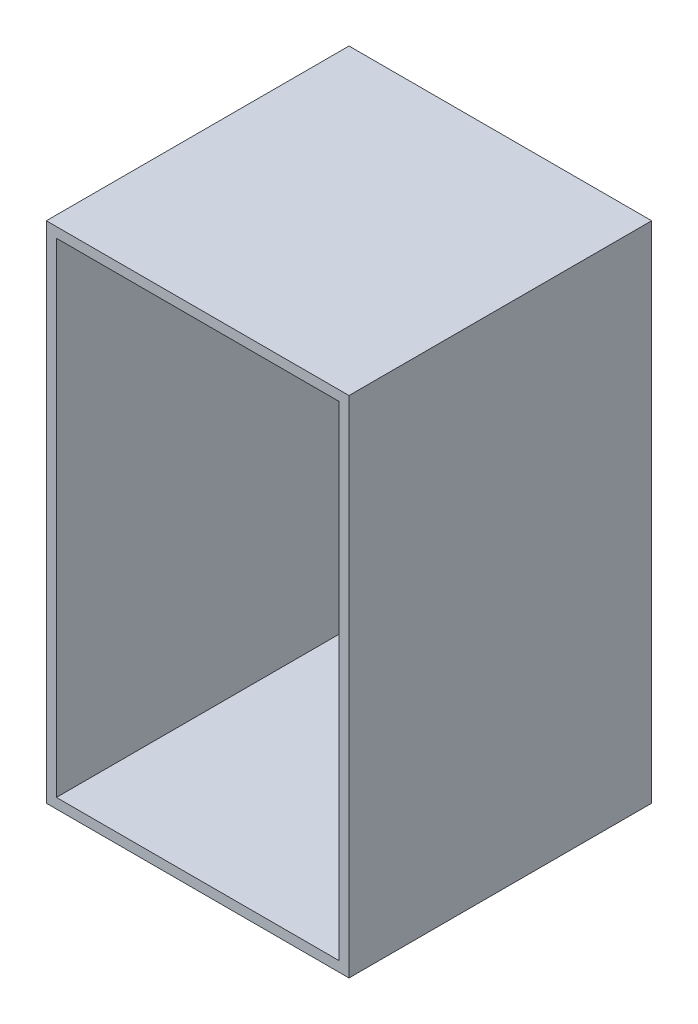
from build123d import *

# Parameters (mm, degrees)
SKETCH1_W                       = 76.2
SKETCH1_H                       = 76.2
BOX_DEPTH                       = 127
HOLLOW_IT_T                     = -2.54
SKETCH2_W                       = 4.318
SKETCH2_H                       = 63.5
SLIDER_TRACK_DEPTH              = 2.54
DPAD_LARGE_SHAPE_DEPTH          = 1.27
SKETCH7_R                       = 2.794
DPAD_TINY_HOLES_DEPTH           = 1.27
SKETCH8_R                       = 12.7
DIAL_LARGE_RING_DEPTH           = 1.27
SKETCH9_R                       = 5.08
DIAL_SMALL_HOLE_DEPTH           = 1.27
SKETCH12_W                      = 8.89
SKETCH12_H                      = 25.4
HOLE_FOR_SCROLL_WHEEL_DEPTH     = 2.54
SKETCH14_R                      = 6.35
NIBBLE_BASE_1_DEPTH             = 5.08
NIBBLE_START                    = -5.08
SKETCH15_R                      = 6.35
NIBBLE_BASE_2_DEPTH             = 5.08
NIBBLE_HOLES_REACH              = 145.381
SKETCH16_R                      = 3.302
NIBBLE_HOLES_DIRECTION_2_REACH  = 145.381
SINGLE_BUTTON_LEG_HOLE_DEPTH    = 2.54
MOAR_LEG_HOLES_COUNT            = 4
BASE_FOR_JOYSTICK_DEPTH         = 3.81
BASE_FOR_JOYSTICK_DEPTH_BACK    = 15.24
SKETCH19_W                      = 45.72
SKETCH19_H                      = 45.72
SKETCH21_W                      = 40.64
SKETCH21_H                      = 40.64
JOYSTICK_HOLE_DEPTH             = 155.861906549
LARGE_NIBBLES_REACH             = 148.689
SKETCH22_R                      = 3.175
LARGE_NIBBLES_DIRECTION_2_REACH = 148.689
SMALL_NIBBLES_REACH             = 134.524
SKETCH23_R                      = 4.445
SMALL_NIBBLES_DIRECTION_2_DEPTH = 48.26


with BuildPart() as part:
    # Sketch1 → box (new body)
    with BuildSketch(Plane(origin=(0, 0, 0), x_dir=(1, 0, 0), z_dir=(0, 1, 0))):
        Rectangle(SKETCH1_W, SKETCH1_H)
    extrude(amount=BOX_DEPTH)

    # hollow it
    hollow_it_openings = [part.faces().sort_by_distance(p)[0] for p in [
        (0, 63.5, 38.1),
    ]]
    offset(amount=HOLLOW_IT_T, openings=hollow_it_openings, kind=Kind.INTERSECTION)

    # Sketch2 → slider track (cut)
    with BuildSketch(Plane(origin=(0, 0, -38.1), x_dir=(-1, 0, 0), z_dir=(0, 0, -1))):
        with Locations((-27.051, 38.1)):
            Rectangle(SKETCH2_W, SKETCH2_H)
    extrude(amount=-SLIDER_TRACK_DEPTH, mode=Mode.SUBTRACT)

    # Sketch6 → dpad large shape (cut)
    with BuildSketch(Plane(origin=(0, 0, -38.1), x_dir=(-1, 0, 0), z_dir=(0, 0, -1))):
        Polygon((-3.297705804, 45.72), (-3.297705804, 52.07), (3.052294196, 52.07), (3.052294196, 45.72), (9.402294196, 45.72), (9.402294196, 39.37), (3.052294196, 39.37), (3.052294196, 33.02), (-3.297705804, 33.02), (-3.297705804, 39.37), (-9.647705804, 39.37), (-9.647705804, 45.72), align=None)
    extrude(amount=-DPAD_LARGE_SHAPE_DEPTH, mode=Mode.SUBTRACT)

    # Sketch7 → dpad tiny holes (cut)
    with BuildSketch(Plane(origin=(0, 0, -36.83), x_dir=(-1, 0, 0), z_dir=(0, 0, -1))):
        with Locations((-0.122705804, 48.895)):
            Circle(SKETCH7_R)
        with Locations((6.227294196, 42.672)):
            Circle(SKETCH7_R)
        with Locations((-0.122705804, 36.195)):
            Circle(SKETCH7_R)
        with Locations((-6.472705804, 42.545)):
            Circle(SKETCH7_R)
    extrude(amount=-DPAD_TINY_HOLES_DEPTH, mode=Mode.SUBTRACT)

    # Sketch8 → dial large ring (cut)
    with BuildSketch(Plane(origin=(0, 0, -38.1), x_dir=(-1, 0, 0), z_dir=(0, 0, -1))):
        with Locations((20.32, 19.05)):
            Circle(SKETCH8_R)
    extrude(amount=-DIAL_LARGE_RING_DEPTH, mode=Mode.SUBTRACT)

    # Sketch9 → dial small hole (cut)
    with BuildSketch(Plane(origin=(0, 0, -36.83), x_dir=(-1, 0, 0), z_dir=(0, 0, -1))):
        with Locations((20.32, 19.05)):
            Circle(SKETCH9_R)
    extrude(amount=-DIAL_SMALL_HOLE_DEPTH, mode=Mode.SUBTRACT)

    # Sketch12 → hole for scroll wheel (cut)
    with BuildSketch(Plane(origin=(0, 0, -38.1), x_dir=(-1, 0, 0), z_dir=(0, 0, -1))):
        with Locations((-6.985, 17.78)):
            Rectangle(SKETCH12_W, SKETCH12_H)
    extrude(amount=-HOLE_FOR_SCROLL_WHEEL_DEPTH, mode=Mode.SUBTRACT)

    # Sketch14 → nibble base 1 (add)
    with BuildSketch(Plane(origin=(2.54, 0, 0), x_dir=(0, 0, -1), z_dir=(1, 0, 0))):
        with Locations((38.1, 17.78)):
            Circle(SKETCH14_R)
    extrude(amount=-NIBBLE_BASE_1_DEPTH)

    # Sketch15 → nibble base 2 (add)
    with BuildSketch(Plane.ZY.offset(-11.43).offset(NIBBLE_START)):
        with Locations((-38.1, 17.78)):
            Circle(SKETCH15_R)
    extrude(amount=NIBBLE_BASE_2_DEPTH)

    # nibble holes: up to this face of the body (flat: up to its plane)
    nibble_holes_end = Plane(part.part.faces().sort_by_distance((16.51, 17.78, -40.795023703))[0])
    # Sketch16 → nibble holes (cut, up to the picked face)
    with BuildSketch(Plane.ZY.offset(-11.43), mode=Mode.PRIVATE) as nibble_holes_sk1:
        with Locations(Location((-38.1, 17.78, 0), (0, 0, 90))):
            Circle(SKETCH16_R)
    nibble_holes_tool1 = split(extrude(nibble_holes_sk1.sketch, amount=-NIBBLE_HOLES_REACH, mode=Mode.PRIVATE), bisect_by=nibble_holes_end, keep=Keep.BOTH, mode=Mode.PRIVATE)
    add(nibble_holes_tool1.solids().sort_by(Axis((11.43, 17.78, -38.1), (1, 0, 0)))[0], mode=Mode.SUBTRACT)

    # nibble holes direction 2: up to this face of the body (flat: up to its plane)
    nibble_holes_direction_2_end = Plane(part.part.faces().sort_by_distance((-2.54, 17.78, -40.795023703))[0])
    # Sketch16 → nibble holes direction 2 (cut, up to the picked face)
    with BuildSketch(Plane.ZY.offset(-11.43), mode=Mode.PRIVATE) as nibble_holes_direction_2_sk1:
        with Locations(Location((-38.1, 17.78, 0), (0, 0, 90))):
            Circle(SKETCH16_R)
    nibble_holes_direction_2_tool1 = split(extrude(nibble_holes_direction_2_sk1.sketch, amount=NIBBLE_HOLES_DIRECTION_2_REACH, mode=Mode.PRIVATE), bisect_by=nibble_holes_direction_2_end, keep=Keep.BOTH, mode=Mode.PRIVATE)
    add(nibble_holes_direction_2_tool1.solids().sort_by(Axis((11.43, 17.78, -38.1), (-1, 0, 0)))[0], mode=Mode.SUBTRACT)

    # Sketch17 → single button leg hole (cut)
    with BuildSketch(Plane(origin=(0, 0, -38.1), x_dir=(-1, 0, 0), z_dir=(0, 0, -1))):
        with BuildLine():
            Line((33.782, 65.405), (33.782, 61.595))
            ThreePointArc((33.782, 61.595), (31.75, 59.563), (29.718, 61.595))
            Line((29.718, 61.595), (29.718, 65.405))
            ThreePointArc((29.718, 65.405), (31.75, 67.437), (33.782, 65.405))
        make_face()
    single_button_leg_hole = extrude(amount=-SINGLE_BUTTON_LEG_HOLE_DEPTH, mode=Mode.SUBTRACT)

    # moar leg holes: single button leg hole ×4 about axis
    moar_leg_holes_axis = Axis((-25.4, 63.5, 0), (0, 0, 1))
    for i in range(1, MOAR_LEG_HOLES_COUNT):
        add(single_button_leg_hole.rotate(moar_leg_holes_axis, i * 360 / MOAR_LEG_HOLES_COUNT), mode=Mode.SUBTRACT)

    # Sketch19 → base for joystick (add, two sides: drawn at the far end of the back side and taken through both)
    with BuildSketch(Plane(origin=(0, 0, -38.1), x_dir=(-1, 0, 0), z_dir=(0, 0, -1)).offset(-BASE_FOR_JOYSTICK_DEPTH_BACK)):
        with Locations((0, 98.571636182)):
            Rectangle(SKETCH19_W, SKETCH19_H)
    extrude(amount=BASE_FOR_JOYSTICK_DEPTH + BASE_FOR_JOYSTICK_DEPTH_BACK)

    # Sketch21 → joystick hole (cut, through all)
    with BuildSketch(Plane(origin=(0, 0, -41.91), x_dir=(-1, 0, 0), z_dir=(0, 0, -1))):
        with Locations((0, 98.571636182)):
            Rectangle(SKETCH21_W, SKETCH21_H)
    extrude(amount=-JOYSTICK_HOLE_DEPTH, mode=Mode.SUBTRACT)

    # large nibbles: up to this face of the body (flat: up to its plane)
    large_nibbles_end = Plane(part.part.faces().sort_by_distance((-22.86, 98.571636182, -40.005))[0])
    # Sketch22 → large nibbles (cut, up to the picked face)
    with BuildSketch(Plane(origin=(-20.32, 0, 0), x_dir=(0, 0, -1), z_dir=(1, 0, 0)), mode=Mode.PRIVATE) as large_nibbles_sk1:
        with Locations((32.385, 98.571636182)):
            Circle(SKETCH22_R)
    large_nibbles_tool1 = split(extrude(large_nibbles_sk1.sketch, amount=-LARGE_NIBBLES_REACH, mode=Mode.PRIVATE), bisect_by=large_nibbles_end, keep=Keep.BOTH, mode=Mode.PRIVATE)
    add(large_nibbles_tool1.solids().sort_by(Axis((-20.32, 98.571636, -32.385), (-1, 0, 0)))[0], mode=Mode.SUBTRACT)

    # large nibbles direction 2: up to this face of the body (flat: up to its plane)
    large_nibbles_direction_2_end = Plane(part.part.faces().sort_by_distance((22.86, 98.571636182, -40.005))[0])
    # Sketch22 → large nibbles direction 2 (cut, up to the picked face)
    with BuildSketch(Plane(origin=(-20.32, 0, 0), x_dir=(0, 0, -1), z_dir=(1, 0, 0)), mode=Mode.PRIVATE) as large_nibbles_direction_2_sk1:
        with Locations((32.385, 98.571636182)):
            Circle(SKETCH22_R)
    large_nibbles_direction_2_tool1 = split(extrude(large_nibbles_direction_2_sk1.sketch, amount=LARGE_NIBBLES_DIRECTION_2_REACH, mode=Mode.PRIVATE), bisect_by=large_nibbles_direction_2_end, keep=Keep.BOTH, mode=Mode.PRIVATE)
    add(large_nibbles_direction_2_tool1.solids().sort_by(Axis((-20.32, 98.571636, -32.385), (1, 0, 0)))[0], mode=Mode.SUBTRACT)

    # small nibbles: up to this face of the body (flat: up to its plane)
    small_nibbles_end = Plane(part.part.faces().sort_by_distance((0, 124.46, 1.27))[0])
    # Sketch23 → small nibbles (cut, up to the picked face)
    with BuildSketch(Plane.XZ.offset(-118.891636182), mode=Mode.PRIVATE) as small_nibbles_sk1:
        with Locations(Location((0, -32.385, 0), (0, 0, 270))):
            Circle(SKETCH23_R)
    small_nibbles_tool1 = split(extrude(small_nibbles_sk1.sketch, amount=-SMALL_NIBBLES_REACH, mode=Mode.PRIVATE), bisect_by=small_nibbles_end, keep=Keep.BOTH, mode=Mode.PRIVATE)
    add(small_nibbles_tool1.solids().sort_by(Axis((0, 118.891636, -32.385), (0, 1, 0)))[0], mode=Mode.SUBTRACT)

    # Sketch23 → small nibbles direction 2 (cut)
    with BuildSketch(Plane.XZ.offset(-118.891636182)):
        with Locations(Location((0, -32.385, 0), (0, 0, 270))):
            Circle(SKETCH23_R)
    extrude(amount=SMALL_NIBBLES_DIRECTION_2_DEPTH, mode=Mode.SUBTRACT)


solid = part.part
